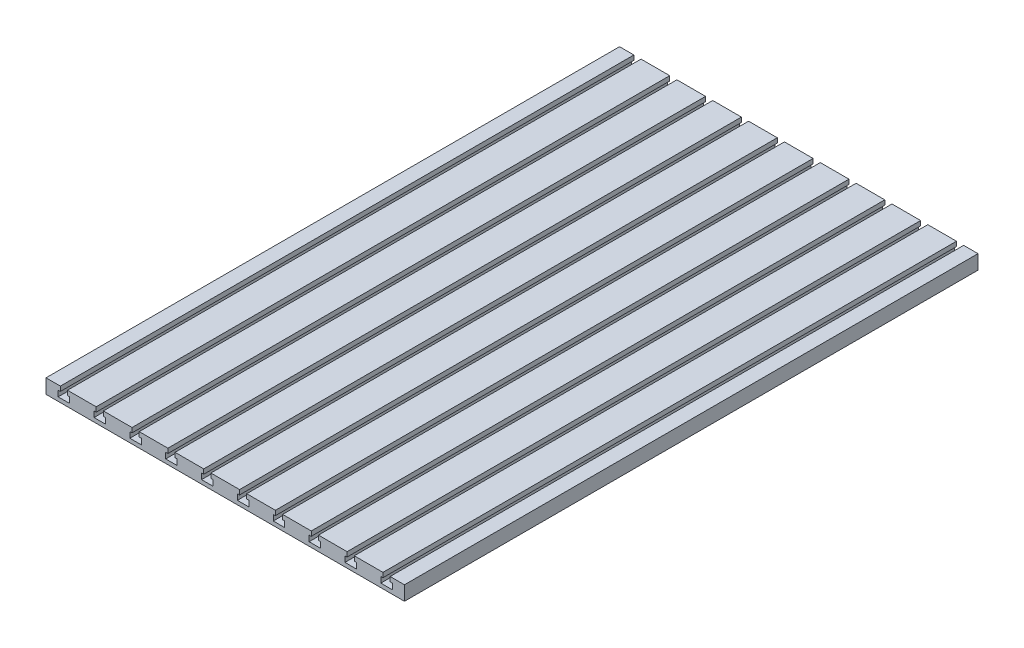
from build123d import *

# Parameters (mm, degrees)
SKETCH1_W           = 500
SKETCH1_H           = 20
BOSS_EXTRUDE1_DEPTH = 800
CUT_EXTRUDE1_DEPTH  = 944.610088967


with BuildPart() as part:
    # Sketch1 → Boss-Extrude1 (new body)
    with BuildSketch(Plane.XY):
        with Locations((-250, 10)):
            Rectangle(SKETCH1_W, SKETCH1_H)
    extrude(amount=BOSS_EXTRUDE1_DEPTH)

    # Sketch2 → Cut-Extrude1 (cut, through all)
    with BuildSketch(Plane.XY.offset(800)):
        Polygon((-480, 20), (-480, 13.5), (-483, 13.5), (-483, 5.5), (-467, 5.5), (-467, 13.5), (-470, 13.5), (-470, 20), align=None)
        Polygon((-430, 20), (-430, 13.5), (-433, 13.5), (-433, 5.5), (-417, 5.5), (-417, 13.5), (-420, 13.5), (-420, 20), align=None)
        Polygon((-380, 20), (-380, 13.5), (-383, 13.5), (-383, 5.5), (-367, 5.5), (-367, 13.5), (-370, 13.5), (-370, 20), align=None)
        Polygon((-330, 20), (-330, 13.5), (-333, 13.5), (-333, 5.5), (-317, 5.5), (-317, 13.5), (-320, 13.5), (-320, 20), align=None)
        Polygon((-280, 20), (-280, 13.5), (-283, 13.5), (-283, 5.5), (-267, 5.5), (-267, 13.5), (-270, 13.5), (-270, 20), align=None)
        Polygon((-230, 20), (-230, 13.5), (-233, 13.5), (-233, 5.5), (-217, 5.5), (-217, 13.5), (-220, 13.5), (-220, 20), align=None)
        Polygon((-180, 20), (-180, 13.5), (-183, 13.5), (-183, 5.5), (-167, 5.5), (-167, 13.5), (-170, 13.5), (-170, 20), align=None)
        Polygon((-130, 20), (-130, 13.5), (-133, 13.5), (-133, 5.5), (-117, 5.5), (-117, 13.5), (-120, 13.5), (-120, 20), align=None)
        Polygon((-80, 20), (-80, 13.5), (-83, 13.5), (-83, 5.5), (-67, 5.5), (-67, 13.5), (-70, 13.5), (-70, 20), align=None)
        Polygon((-30, 20), (-30, 13.5), (-33, 13.5), (-33, 5.5), (-17, 5.5), (-17, 13.5), (-20, 13.5), (-20, 20), align=None)
    extrude(amount=-CUT_EXTRUDE1_DEPTH, mode=Mode.SUBTRACT)


solid = part.part
